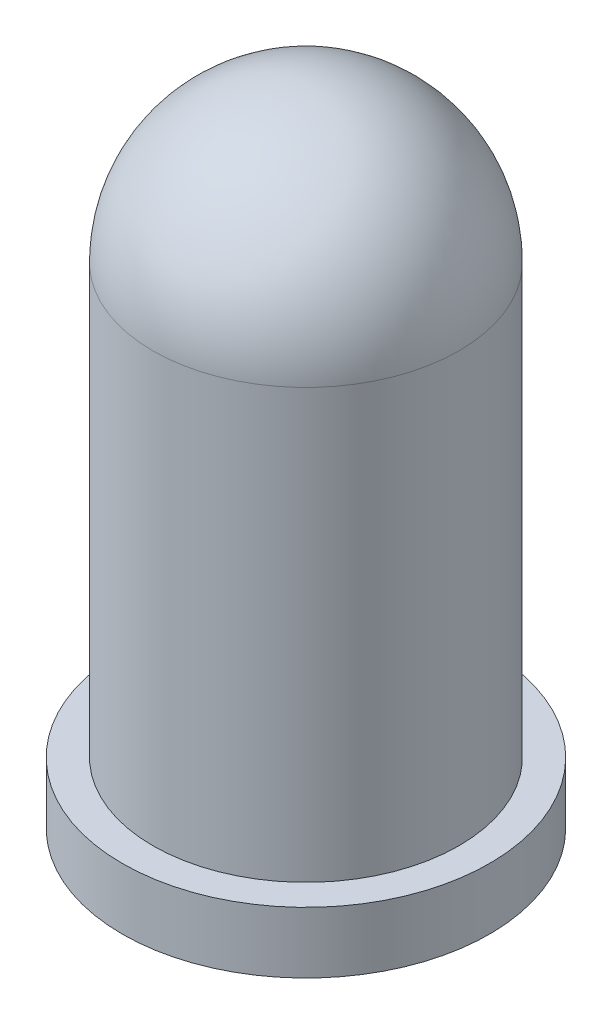
from build123d import *


with BuildPart() as part:
    # Sketch1 → Revolve1 (revolve)
    with BuildSketch(Plane.XY, mode=Mode.PRIVATE) as revolve1_sk:
        with BuildLine():
            ThreePointArc((2.5, 50.522712725), (1.767766953, 52.290479678), (0, 53.022712725))
            Line((0, 53.022712725), (0, 42.522712725))
            Line((0, 42.522712725), (3, 42.522712725))
            Line((3, 42.522712725), (3, 43.522712725))
            Line((3, 43.522712725), (2.5, 43.522712725))
            Line((2.5, 43.522712725), (2.5, 50.522712725))
        make_face()
    revolve(revolve1_sk.sketch.rotate(Axis((0, 78.413353264, 0), (0, -1, 0)), 90), axis=Axis((0, 78.413353264, 0), (0, -1, 0)))


solid = part.part
